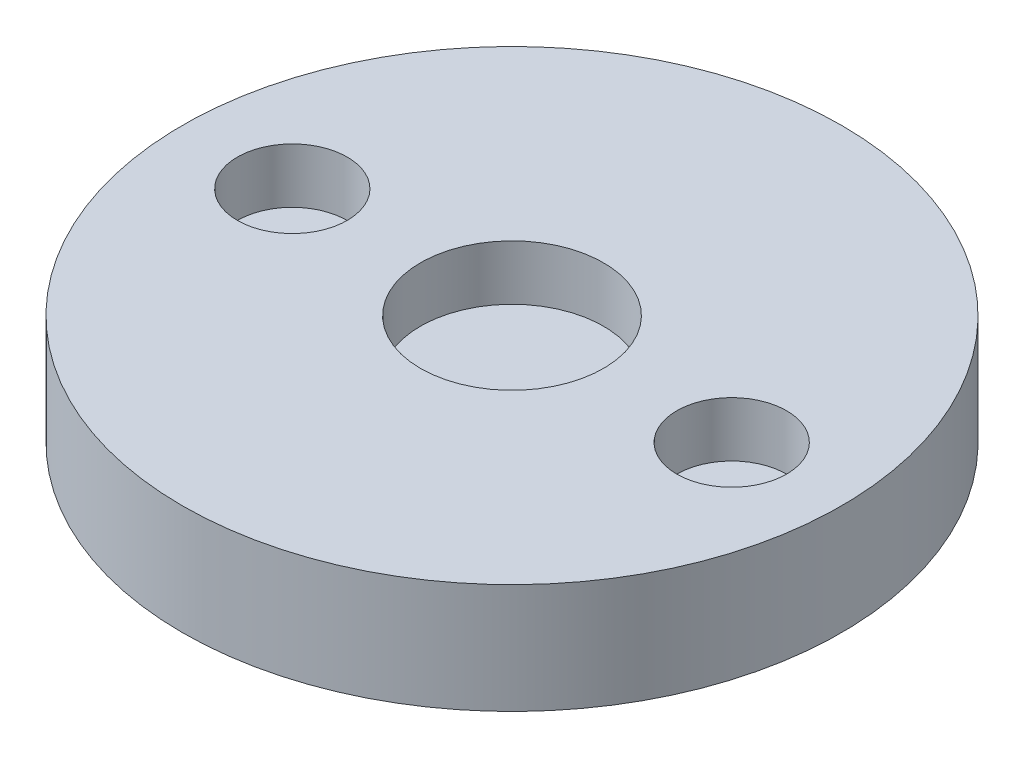
from build123d import *

# Parameters (mm, degrees)
SKETCH1_R           = 9
BOSS_EXTRUDE1_DEPTH = 3
SKETCH2_R           = 2.5
SKETCH2_R_2         = 1.5
CUT_EXTRUDE1_DEPTH  = 1.5


with BuildPart() as part:
    # Sketch1 → Boss-Extrude1 (new body)
    with BuildSketch(Plane(origin=(0, 0, 0), x_dir=(1, 0, 0), z_dir=(0, 1, 0))):
        with Locations(Location((0, 0, 0), (0, 0, 270))):
            Circle(SKETCH1_R)
    extrude(amount=BOSS_EXTRUDE1_DEPTH)

    # Sketch2 → Cut-Extrude1 (cut)
    with BuildSketch(Plane(origin=(0, 3, 0), x_dir=(1, 0, 0), z_dir=(0, 1, 0))):
        with Locations(Location((0, 0, 0), (0, 0, 270))):
            Circle(SKETCH2_R)
        with Locations(Location((-6, 0, 0), (0, 0, 270))):
            Circle(SKETCH2_R_2)
        with Locations(Location((6, 0, 0), (0, 0, 270))):
            Circle(SKETCH2_R_2)
    extrude(amount=-CUT_EXTRUDE1_DEPTH, mode=Mode.SUBTRACT)


solid = part.part
